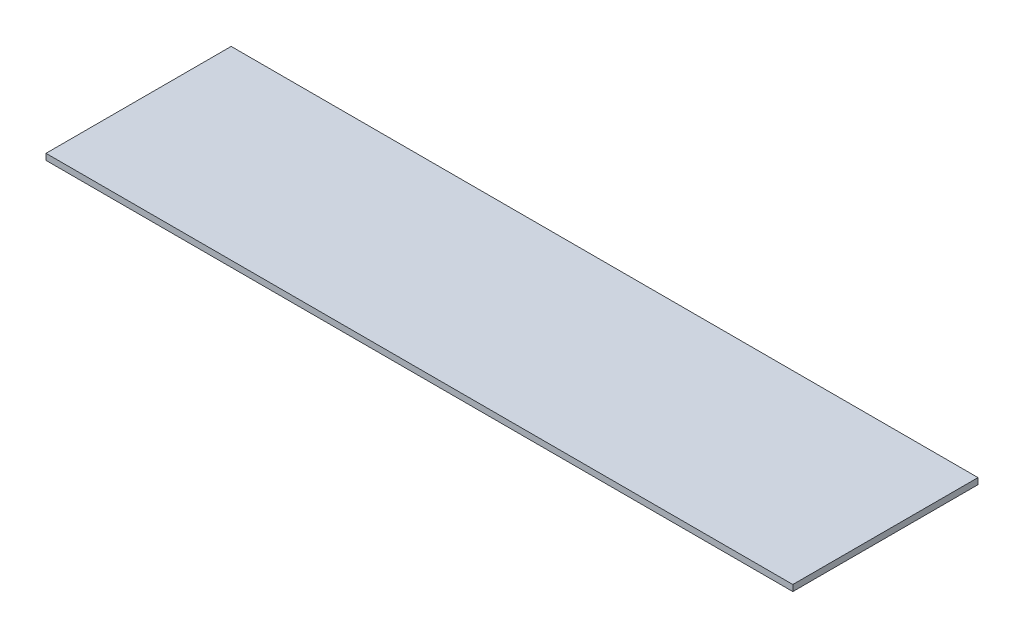
from build123d import *

# Parameters (mm, degrees)
ESQUISSE1_W        = 1210
ESQUISSE1_H        = 300
BOSS_EXTRU_1_DEPTH = 10


with BuildPart() as part:
    # Esquisse1 → Boss.-Extru.1 (new body)
    with BuildSketch(Plane(origin=(0, 0, 0), x_dir=(1, 0, 0), z_dir=(0, 1, 0))):
        Rectangle(ESQUISSE1_W, ESQUISSE1_H)
    extrude(amount=BOSS_EXTRU_1_DEPTH)


solid = part.part
